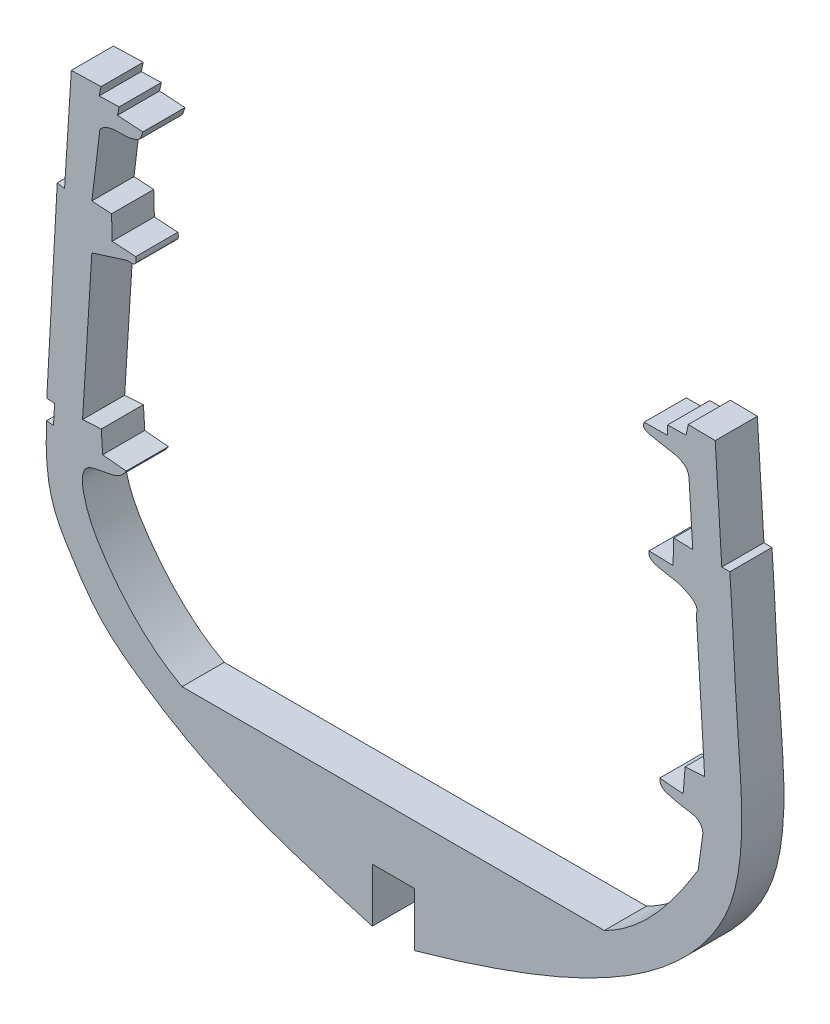
from build123d import *

# Parameters (mm, degrees)
EXTRUDE_1_DEPTH = 8


with BuildPart() as part:
    # 草图1 → 凸台-拉伸1 (new body)
    with BuildSketch(Plane.XY):
        with BuildLine():
            Line((1124.028471583, 520.430109722), (1204.174904035, 520.430070778))
            add(Edge.make_bspline(
                [(1204.174904035, 520.430070778), (1212.085738121, 524.363222827), (1217.423615756, 531.925431574), (1221.963933213, 539.201405051)],
                knots=[0, 0, 0, 0, 1, 1, 1, 1], degree=3))
            Line((1221.963933213, 539.201405051), (1222.874728164, 545.726294408))
            add(Edge.make_bspline(
                [(1214.682588776, 550.739620034), (1214.671338256, 549.270061767), (1216.703883787, 548.726941269), (1219.946084595, 547.952502949), (1222.652477024, 547.941581282), (1222.874728164, 545.726294408)],
                knots=[0, 0, 0, 0, 0.316887322, 0.54582777, 1, 1, 1, 1], degree=3))
            Line((1214.682588776, 550.739620034), (1219.115415172, 550.367137409))
            Line((1219.115415172, 550.367137409), (1219.505320224, 555.007303918))
            Line((1219.505320224, 555.007303918), (1223.202343642, 555.231820955))
            Line((1223.202343642, 555.231820955), (1221.627082304, 581.170957375))
            add(Edge.make_bspline(
                [(1212.636585977, 587.043374717), (1212.454677562, 585.796181195), (1213.890055348, 585.378825619), (1216.221373323, 584.879752933), (1218.255242025, 584.695475039), (1220.659922483, 583.469719419), (1222.1127384, 582.509625086), (1221.627082304, 581.170957375)],
                knots=[0, 0, 0, 0, 0.239209187, 0.312947279, 0.612237184, 0.732749875, 1, 1, 1, 1], degree=3))
            Line((1212.636585977, 587.043374717), (1217.210449531, 586.937165754))
            Line((1217.210449531, 586.937165754), (1217.316487411, 591.503661615))
            Line((1217.316487411, 591.503661615), (1220.948759853, 591.41931719))
            Line((1220.948759853, 591.41931719), (1220.250872886, 602.571160309))
            add(Edge.make_bspline(
                [(1211.716465331, 607.740861376), (1211.187854841, 606.401817151), (1213.004759262, 606.264901424), (1215.196317894, 605.726179758), (1217.952697521, 605.533186742), (1220.225941655, 604.310982986), (1220.250872886, 602.571160309)],
                knots=[0, 0, 0, 0, 0.266116432, 0.349469371, 0.634145719, 1, 1, 1, 1], degree=3))
            Line((1211.716465331, 607.740861376), (1216.197671159, 607.803768601))
            Line((1216.197671159, 607.803768601), (1216.173557796, 609.521487724))
            Line((1216.173557796, 609.521487724), (1219.67550319, 609.570648078))
            Line((1219.67550319, 609.570648078), (1220.095083915, 611.544620192))
            Line((1220.095083915, 611.544620192), (1225.209117986, 611.46272634))
            Line((1225.209117986, 611.46272634), (1226.454457575, 591.298355637))
            Line((1226.454457575, 591.298355637), (1227.981133702, 591.284940949))
            add(Edge.make_bspline(
                [(1176.413358607, 501.541603889), (1185.511965328, 504.430669174), (1199.8218076, 509.491630158), (1217.865884469, 520.93290627), (1227.246018242, 532.266979554), (1231.059303267, 548.101040116), (1229.136307234, 566.682588001), (1228.599899115, 582.721408894), (1227.981133702, 591.284940949)],
                knots=[0, 0, 0, 0, 0.241209395, 0.378188323, 0.536810948, 0.593324023, 0.784372166, 1, 1, 1, 1], degree=3))
            Line((1176.413358607, 501.541603889), (1168.127567544, 499.103770177))
            Line((1168.127567544, 499.103770177), (1168.138433182, 509.308763091))
            Line((1168.138433182, 509.308763091), (1160.139894251, 509.317279435))
            Line((1160.139894251, 509.317279435), (1160.12903005, 499.113636864))
            add(Edge.make_bspline(
                [(1098.311715911, 551.293740787), (1098.16271854, 546.876679985), (1098.130057814, 539.47225151), (1103.429856905, 530.668564811), (1108.654696706, 522.952772916), (1117.543965476, 516.51310893), (1133.947418206, 506.654111254), (1149.153303542, 502.297432674), (1160.12903005, 499.113636864)],
                knots=[0, 0, 0, 0, 0.154650045, 0.237651291, 0.346708414, 0.470354138, 0.607131876, 1, 1, 1, 1], degree=3))
            Line((1098.311715911, 551.293740787), (1099.635988728, 551.132362423))
            Line((1099.635988728, 551.132362423), (1099.841894023, 554.902636544))
            Line((1099.841894023, 554.902636544), (1098.358655386, 554.983640386))
            Line((1098.358655386, 554.983640386), (1100.348039848, 591.410701366))
            Line((1100.348039848, 591.410701366), (1101.728076895, 591.117365436))
            Line((1101.728076895, 591.117365436), (1103.010262599, 611.21116483))
            Line((1103.010262599, 611.21116483), (1108.661620257, 611.362923176))
            Line((1108.661620257, 611.362923176), (1108.297361895, 609.649222315))
            Line((1108.297361895, 609.649222315), (1112.095812339, 609.751223744))
            Line((1112.095812339, 609.751223744), (1111.764897573, 608.194392169))
            Line((1111.764897573, 608.194392169), (1116.590439522, 607.886474249))
            Line((1116.590439522, 607.886474249), (1116.117932629, 606.507199486))
            add(Edge.make_bspline(
                [(1116.117932629, 606.507199486), (1113.791096831, 604.571413999), (1110.612497209, 606.648870888), (1108.442315229, 604.251277774)],
                knots=[0, 0, 0, 0, 1, 1, 1, 1], degree=3))
            Line((1108.442315229, 604.251277774), (1106.91226392, 591.695658143))
            Line((1106.91226392, 591.695658143), (1110.652746305, 591.456977894))
            Line((1110.652746305, 591.456977894), (1110.772315662, 587.00431205))
            Line((1110.772315662, 587.00431205), (1115.239758205, 586.71924446))
            add(Edge.make_bspline(
                [(1115.239758205, 586.71924446), (1115.70122676, 584.894177675), (1113.703765277, 585.306322128)],
                knots=[0, 0, 0, 1, 1, 1], degree=2))
            Line((1113.703765277, 585.306322128), (1106.91182657, 583.163333421))
            Line((1106.91182657, 583.163333421), (1105.144282892, 554.880236524))
            Line((1105.144282892, 554.880236524), (1108.69591202, 555.10705587))
            Line((1108.69591202, 555.10705587), (1108.95798166, 551.003463381))
            Line((1108.95798166, 551.003463381), (1113.434502264, 550.572955239))
            add(Edge.make_bspline(
                [(1124.028471583, 520.430109722), (1117.738543153, 523.748339757), (1110.715887779, 531.421288497), (1105.5970408, 540.587975664), (1104.461450054, 547.162517108), (1109.338415048, 548.524619873), (1112.276628203, 548.43481463), (1113.434502264, 550.572955239)],
                knots=[0, 0, 0, 0, 0.510505694, 0.664272713, 0.808402457, 0.847338435, 1, 1, 1, 1], degree=3))
        make_face()
    extrude(amount=EXTRUDE_1_DEPTH)


solid = part.part
